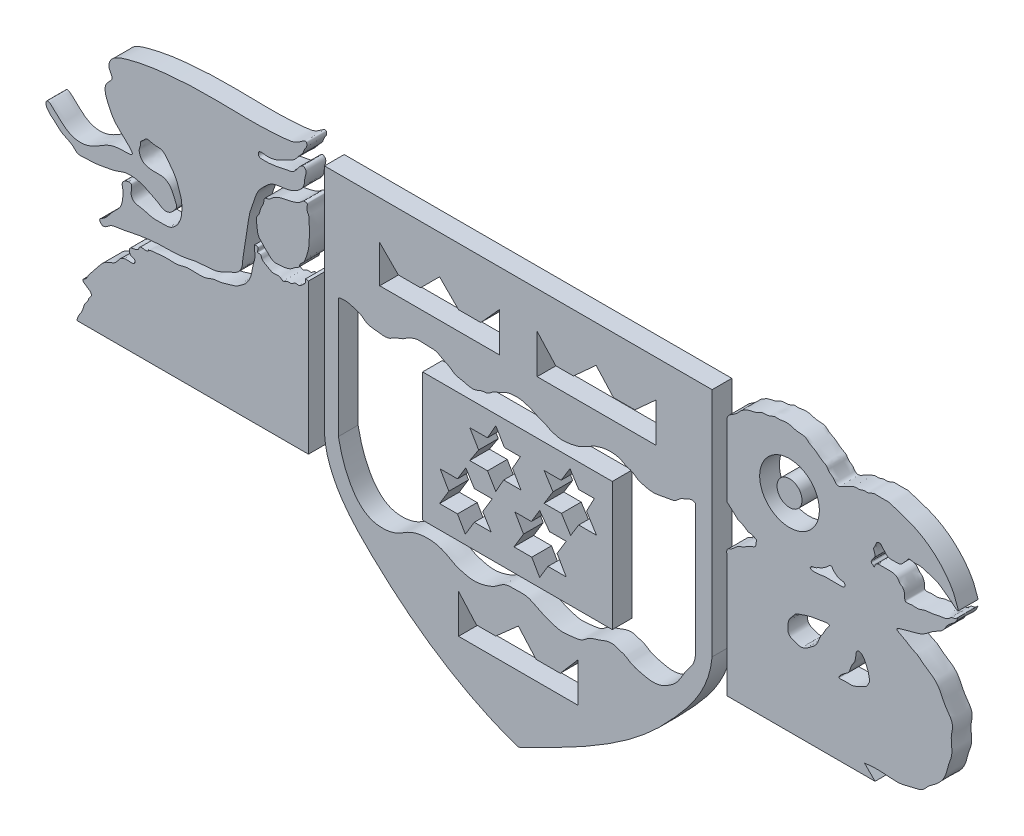
from build123d import *

# Parameters (mm, degrees)
SKETCH2_R             = 12.689747712
BOSS_EXTRUDE3_DEPTH   = 20
BOSS_EXTRUDE3_2_DEPTH = 20
BOSS_EXTRUDE3_3_DEPTH = 20
BOSS_EXTRUDE3_4_DEPTH = 20
BOSS_EXTRUDE3_5_DEPTH = 20
SKETCH2_W             = 192.522492042
SKETCH2_H             = 130.270801866
BOSS_EXTRUDE3_6_DEPTH = 20
SKETCH2_R_2           = 30.288047094
BOSS_EXTRUDE3_7_DEPTH = 20


with BuildPart() as part:
    # Sketch2 → Boss-Extrude3 (new body)
    with BuildSketch(Plane.XY):
        with Locations((273.141483895, 134.98628142)):
            Circle(SKETCH2_R)
    extrude(amount=BOSS_EXTRUDE3_DEPTH)


with BuildPart() as body_2:
    # Sketch2 → Boss-Extrude3 2 (new body)
    with BuildSketch(Plane.XY):
        with BuildLine():
            add(Edge.make_bspline(
                [(-481.365479162, 101.585089884), (-479.980275311, 107.590250914), (-458.884152858, 78.766782185), (-432.297797759, 84.675797976), (-415.385077689, 99.480070901), (-383.801991468, 96.053798849), (-410.328660839, 114.895950043), (-417.731362499, 129.66579025), (-425.618059534, 146.346775651), (-411.770282092, 155.390345469), (-419.121341407, 163.190583081), (-415.696788893, 174.003216805), (-403.86710429, 179.019176508), (-389.053447552, 182.771707918), (-370.908784754, 186.149129144), (-350.365415117, 188.189023369), (-325.915880829, 189.584768223), (-301.234129311, 189.367115347), (-275.381876158, 188.798506457), (-254.486466215, 189.08204438), (-236.560936818, 190.50116447), (-226.473154275, 192.43258324), (-216.860840656, 201.207128028), (-216.492382736, 194.193338735), (-219.576534764, 191.354765344), (-220.29058751, 186.677056338), (-224.856656335, 182.807848669), (-228.52136423, 176.665982495), (-236.783243501, 172.732579226), (-246.531612535, 167.452898195), (-255.512863483, 165.037111719), (-265.938700098, 167.460335412), (-266.249466519, 160.893656939), (-257.82181752, 160.479683657), (-248.948232475, 161.280758527), (-238.570413302, 163.895990267), (-227.544302831, 165.278963495), (-222.582789357, 178.687875877), (-216.508689646, 172.377223801), (-219.372025456, 166.566536385), (-218.720847421, 158.945480954), (-225.349302089, 150.942540946), (-237.481544296, 145.78405192), (-251.41219105, 146.29638615), (-259.735022438, 138.060456086), (-267.467361444, 130.653499517), (-270.475281553, 119.414736282), (-275.20396066, 107.597328411), (-276.198674872, 98.261254885), (-278.32821889, 87.630315093), (-279.100810216, 77.05197206), (-282.077016402, 65.509781745), (-281.823550518, 56.192135709), (-286.470421625, 48.342117997), (-296.361952965, 45.287992763), (-308.611417088, 37.507253371), (-325.585507364, 39.046445104), (-343.486269973, 33.717636972), (-359.955362916, 34.110553795), (-374.537681036, 33.294154813), (-389.894686996, 31.200922544), (-403.684284945, 27.625169058), (-416.716050535, 26.636104026), (-423.130522175, 18.73459674), (-428.637355706, 25.969782735), (-420.511815778, 29.199969904), (-417.014085854, 35.542753021), (-410.691152946, 41.717706696), (-404.871313248, 47.376562779), (-403.567933606, 55.854074579), (-402.987348257, 63.034706538), (-405.764243044, 71.384493611), (-392.650031265, 75.50950775), (-395.336553603, 66.593158231), (-395.117285701, 61.449014886), (-391.127959128, 57.064687807), (-382.945117458, 56.919958833), (-374.235234848, 52.981086428), (-364.471645886, 53.928957337), (-356.446751444, 53.311885335), (-350.278159727, 57.327388937), (-346.105681775, 62.856016192), (-343.711736165, 70.095154761), (-343.626161289, 77.56627044), (-343.791995542, 84.295804036), (-346.329637131, 91.106299113), (-348.369348968, 98.112056716), (-352.399105007, 105.360108321), (-356.811839102, 110.481622303), (-359.969002167, 115.012208001), (-364.670703627, 119.240782508), (-371.816881001, 117.681516881), (-379.41461789, 121.511647221), (-382.545960318, 116.827961889), (-386.337702442, 115.133253327), (-385.446480736, 110.669016053), (-387.003470499, 107.916060752), (-386.921760991, 104.410685779), (-385.732530374, 101.40736836), (-383.328906752, 97.610657514), (-377.083981788, 95.177150177), (-369.575900005, 95.156945905), (-362.020119857, 95.431009276), (-356.954631877, 92.165186518), (-353.95778307, 88.460275765), (-352.210019269, 83.928026038), (-350.35078436, 80.330224774), (-348.885754311, 76.915885278), (-349.258130439, 73.625031082), (-351.630656384, 71.146742994), (-354.378125207, 67.648755655), (-359.510905179, 65.593320291), (-364.481495431, 67.417876036), (-368.729772839, 70.844430826), (-374.096923615, 72.806079221), (-379.103264081, 75.945129712), (-384.033652411, 77.748480258), (-389.149976976, 79.556085052), (-395.226541794, 80.025268826), (-401.419759913, 79.799730414), (-407.107925804, 77.470718081), (-413.076377516, 75.542197964), (-418.881905024, 74.496544539), (-425.283159895, 73.177939451), (-433.522778079, 72.189202148), (-441.733778802, 72.212277585), (-449.424512029, 71.396552165), (-452.480725487, 74.87470275), (-457.282649404, 79.097881682), (-465.795899296, 81.494901295), (-471.335484496, 87.992313956), (-476.255506454, 91.449710531), (-479.095774129, 94.870619849), (-481.683800804, 97.985478923), (-481.556668738, 100.756241342), (-481.365479162, 101.585089884)],
                knots=[0, 0, 0, 0, 0.01770505, 0.043382401, 0.063353068, 0.07559002, 0.095889966, 0.105370566, 0.122865266, 0.129644926, 0.136402176, 0.142815438, 0.154224989, 0.165440181, 0.180768252, 0.19897202, 0.215876249, 0.240480477, 0.259273961, 0.278734336, 0.29230925, 0.301056126, 0.308129717, 0.310916149, 0.313831772, 0.318232341, 0.321559668, 0.328065109, 0.335248779, 0.343314382, 0.354742135, 0.360031, 0.362484834, 0.366861025, 0.376163259, 0.386745595, 0.392022786, 0.403564489, 0.405218727, 0.410819549, 0.416795828, 0.423753296, 0.434079113, 0.448613979, 0.454979546, 0.461868552, 0.474525629, 0.482328389, 0.493002349, 0.497201964, 0.508806894, 0.518781492, 0.526207695, 0.531078463, 0.539795189, 0.55032542, 0.565935551, 0.579331429, 0.595672121, 0.605749736, 0.61499398, 0.633505642, 0.640076904, 0.647400555, 0.651010123, 0.65490985, 0.663775226, 0.669553271, 0.676301209, 0.682985492, 0.689559267, 0.694460558, 0.701721735, 0.707402776, 0.710306345, 0.714723536, 0.720005089, 0.729591979, 0.737422381, 0.743695996, 0.748613814, 0.754589247, 0.760379373, 0.766858179, 0.772776386, 0.776612602, 0.784492867, 0.790564641, 0.79668319, 0.80088864, 0.804210332, 0.811210588, 0.81816357, 0.819669132, 0.82442001, 0.826202298, 0.829882386, 0.831776066, 0.834555599, 0.837702914, 0.842439711, 0.849958657, 0.856253229, 0.860209859, 0.86417144, 0.867706351, 0.871986834, 0.874097575, 0.876683385, 0.879479835, 0.882250829, 0.88759929, 0.891481326, 0.894602314, 0.900884939, 0.905226134, 0.908975692, 0.913669804, 0.918396655, 0.923777065, 0.928593438, 0.933269613, 0.939087228, 0.94295169, 0.949253844, 0.959102968, 0.963940894, 0.966224821, 0.96993218, 0.979610841, 0.986701986, 0.990337161, 0.994199725, 0.997556301, 1, 1, 1, 1], degree=3))
        make_face()
    extrude(amount=BOSS_EXTRUDE3_2_DEPTH)


with BuildPart() as body_3:
    # Sketch2 → Boss-Extrude3 3 (new body)
    with BuildSketch(Plane.XY):
        with BuildLine():
            add(Edge.make_bspline(
                [(-216.951067035, 145.125039879), (-215.564871807, 144.727941909), (-217.95863392, 139.042124698), (-214.470723472, 135.534264779), (-214.654783124, 130.866944718), (-214.520062246, 126.662593055), (-214.003740754, 122.587919073), (-214.206308686, 118.502559523), (-214.343075276, 114.194361482), (-214.382888083, 109.612097474), (-215.205445181, 104.309219763), (-216.531648429, 99.785240938), (-218.097713878, 95.428447113), (-219.455978691, 91.071811125), (-223.782688489, 88.918545588), (-224.492122321, 83.945799355), (-229.018402804, 82.619722978), (-232.11244182, 79.298454666), (-238.13023219, 76.865887751), (-243.886213683, 76.670940558), (-249.973825602, 76.19582064), (-253.638411146, 78.409241387), (-256.402655729, 81.748699043), (-259.872496494, 84.204469848), (-262.007207539, 87.288332125), (-265.036910636, 89.798187236), (-266.93845795, 93.712041116), (-267.09277614, 98.431723123), (-268.094158115, 103.097491093), (-268.143379305, 107.84790914), (-264.371866192, 111.509767904), (-264.240502116, 117.601312223), (-259.973724448, 121.916929008), (-260.6972662, 128.517465699), (-255.068375882, 128.580478227), (-251.960203547, 132.256168391), (-247.595248189, 134.832132206), (-243.15319706, 136.423738754), (-237.551813552, 137.418919998), (-232.086186743, 138.696469766), (-226.365184804, 140.464861491), (-222.781590852, 142.675188753), (-220.422545984, 145.293428583), (-218.425829381, 145.057651585), (-217.366481619, 145.244042083), (-216.951067035, 145.125039879)],
                knots=[0, 0, 0, 0, 0.028024893, 0.053073499, 0.072937865, 0.095207576, 0.117973658, 0.134884403, 0.157284325, 0.183515926, 0.204379478, 0.238643086, 0.254742122, 0.275232466, 0.305719409, 0.319238498, 0.345145347, 0.367469692, 0.388393031, 0.44111256, 0.454979686, 0.479822121, 0.501595531, 0.521231493, 0.543540581, 0.557888789, 0.58057296, 0.606863395, 0.628752125, 0.654184247, 0.673660057, 0.704075056, 0.739613203, 0.763030853, 0.782855235, 0.80832766, 0.834514151, 0.858981918, 0.879680065, 0.920777283, 0.944635865, 0.9694807, 0.986384132, 0.991601508, 1, 1, 1, 1], degree=3))
        make_face()
    extrude(amount=BOSS_EXTRUDE3_3_DEPTH)


with BuildPart() as body_4:
    # Sketch2 → Boss-Extrude3 4 (new body)
    with BuildSketch(Plane.XY):
        with BuildLine():
            Line((-215.137157753, 77.264201127), (-215.137157753, -74.946862607))
            Line((-215.137157753, -74.946862607), (-450.020089247, -74.946862607))
            add(Edge.make_bspline(
                [(-450.020089247, -74.946862607), (-449.783324712, -69.871368631), (-444.054919287, -65.348619869), (-443.09641741, -56.840491052), (-438.998313563, -53.190798404), (-438.203449655, -48.732336328), (-435.394480979, -46.551008217), (-435.378336939, -43.644597857), (-437.401261936, -41.839687438), (-439.751051441, -40.624009043), (-441.571983444, -38.728668329), (-444.15463442, -37.83817838), (-444.174203853, -35.157025744), (-440.831616858, -34.101005905), (-439.218535933, -30.404390521), (-436.613524127, -26.759561184), (-433.665592734, -22.969110128), (-430.085792185, -19.232909174), (-427.112460465, -14.750850418), (-423.717721475, -10.968844625), (-418.3093411, -7.321217422), (-410.491161787, -5.822442814), (-406.294166325, 3.161116427), (-398.616285574, 4.247644977), (-392.547502416, 3.000263195), (-391.058327066, 5.609946544), (-390.890914453, 8.453796616), (-395.768014228, 8.472219537), (-397.076899617, 12.386946297), (-396.334188418, 17.850326888), (-388.108801449, 15.657958469), (-386.366282511, 23.815965819), (-379.941806899, 20.179013309), (-376.314551774, 24.060650804), (-369.836961265, 24.505137138), (-363.197280711, 25.430923319), (-354.958285064, 25.418921279), (-347.328078543, 24.603978188), (-339.644361023, 27.936485312), (-331.674241455, 27.272064028), (-324.616585006, 27.227894882), (-317.868649098, 27.920112929), (-311.880385945, 31.151066913), (-303.096864166, 31.118835384), (-295.395730242, 34.546800023), (-288.170623987, 35.798584674), (-284.576688769, 38.982757537), (-278.878831182, 42.315075355), (-274.733651852, 48.408496524), (-272.49255624, 56.124183103), (-271.717830589, 62.444505848), (-269.815342141, 68.273155522), (-269.043718706, 72.808829046), (-269.885269351, 76.218700358), (-269.941766383, 78.695368384), (-269.601241778, 81.009835196), (-270.038930975, 81.567223951)],
                knots=[0, 0, 0, 0, 0.047871828, 0.066458996, 0.082725383, 0.100800293, 0.10992971, 0.116245522, 0.127541214, 0.13510863, 0.143157426, 0.15480681, 0.157507012, 0.168137701, 0.183324435, 0.197615104, 0.213720545, 0.232110517, 0.250062749, 0.268335386, 0.283322162, 0.316033343, 0.343418096, 0.373101464, 0.390342963, 0.396144131, 0.401832984, 0.415502922, 0.431642301, 0.437474586, 0.467946999, 0.480849268, 0.503638649, 0.515548022, 0.530331666, 0.567145531, 0.584760883, 0.613987862, 0.643782069, 0.666901782, 0.694106334, 0.716002753, 0.734802176, 0.761919152, 0.802723158, 0.82004862, 0.834609979, 0.850441366, 0.88713084, 0.905259087, 0.932159326, 0.951457058, 0.967644914, 0.978257754, 0.985864617, 0.99515669, 0.99515669, 0.99515669, 0.99515669], degree=3))
            add(Edge.make_bspline(
                [(-270.038930975, 81.567223951), (-269.813018793, 81.650468126), (-265.23005933, 82.396248602), (-266.457144665, 79.542504526), (-267.173105683, 75.827659903), (-263.419305602, 77.205474382), (-262.753237165, 71.949453977), (-256.990792499, 69.788469851), (-251.393026082, 64.999663298), (-244.707637464, 67.74510224), (-240.613116188, 62.832280936), (-236.741629695, 67.340044482), (-232.000764515, 65.362699839), (-229.179239898, 69.68879989), (-224.312867286, 67.721676385), (-220.622561297, 71.641460912), (-217.337956114, 74.320089554), (-218.324929756, 78.038959201), (-216.9945653, 77.88468765), (-215.740539429, 77.419819976), (-215.137157753, 77.264201127)],
                knots=[-0.003181907, -0.003181907, -0.003181907, -0.003181907, 0, 0.058315799, 0.090029056, 0.118904215, 0.17105142, 0.251574332, 0.371644178, 0.456214784, 0.511488875, 0.583928697, 0.637245157, 0.696302585, 0.756006237, 0.818658482, 0.905355023, 0.924418047, 0.939066288, 0.955633188, 0.955633188, 0.955633188, 0.955633188], degree=3))
        make_face()
    extrude(amount=BOSS_EXTRUDE3_4_DEPTH)


with BuildPart() as body_5:
    # Sketch2 → Boss-Extrude3 5 (new body)
    with BuildSketch(Plane.XY):
        with BuildLine():
            Line((-198.877820034, -48.265057327), (-198.877820034, 186.625479419))
            Line((-198.877820034, 186.625479419), (194.559406701, 186.625479419))
            Line((194.559406701, 186.625479419), (194.559406701, -48.265057327))
            add(Edge.make_bspline(
                [(194.559406701, -48.265057327), (191.810261199, -80.007541575), (168.923800063, -107.567644092), (106.16736638, -173.992617559), (47.742778933, -201.429234081), (-2.103341098, -226.009245766)],
                knots=[0, 0, 0, 0, 0.32922987, 0.379049607, 1, 1, 1, 1], degree=3))
            add(Edge.make_bspline(
                [(-198.877820034, -48.265057327), (-197.882863825, -70.527643704), (-183.242653451, -98.635720951), (-119.713985598, -164.80305689), (-60.929410609, -205.761019493), (-2.103341098, -226.009245766)],
                knots=[0, 0, 0, 0, 0.239264192, 0.328030027, 1, 1, 1, 1], degree=3))
        make_face()
        Polygon((-21.357153012, 109.269215941), (-142.803622278, 109.269215941), (-142.803622278, 147.23212508), (-123.822167709, 128.25067051), (-101.350030663, 128.25067051), (-82.080387645, 147.520313528), (-62.810744628, 128.25067051), (-40.245339488, 128.25067051), (-21.357153012, 149.085563608), align=None, mode=Mode.SUBTRACT)
        Polygon((16.970211381, 109.269215941), (137.833281609, 109.269215941), (137.833281609, 149.311432102), (116.168186011, 129.671470741), (94.452925279, 129.671470741), (76.810199002, 149.133390466), (53.800156051, 128.274200049), (35.879599154, 128.274200049), (16.970211381, 149.133390466), align=None, mode=Mode.SUBTRACT)
        Polygon((-62.810744628, -158.8379751), (58.604062432, -158.8379751), (58.604062432, -118.678786853), (40.435937309, -139.738404145), (15.869212939, -139.738404145), (-2.103341098, -119.441738133), (-25.02466048, -139.738404145), (-44.6465631, -139.738404145), (-62.810744628, -119.225330429), align=None, mode=Mode.SUBTRACT)
        with BuildLine():
            Line((-184.783882303, 77.809297223), (-184.783882303, -44.26966337))
            add(Edge.make_bspline(
                [(-184.783882303, -44.26966337), (-181.708800441, -61.188580076), (-169.830327615, -100.174378016), (-136.507082538, -103.015023704), (-124.001807238, -99.631365149), (-111.7127697, -90.55663681), (-97.781362439, -87.561833984), (-84.520889539, -89.058612111), (-75.902824104, -92.147537597), (-67.784938136, -97.43508406), (-58.062244216, -100.684808824), (-46.954245007, -103.027316407), (-35.539965905, -100.778023145), (-24.711662643, -96.586691923), (-16.413746978, -88.638986987), (-4.655382205, -89.15816339), (6.716642421, -87.978397077), (17.807076428, -94.42159982), (28.95050952, -99.003445296), (41.39996736, -103.24269935), (52.474480993, -101.30135204), (63.058231603, -100.423560518), (69.758864933, -93.096281425), (78.576324077, -91.56002556), (85.858902291, -88.236994134), (93.456436742, -86.525514097), (100.292799737, -89.19746963), (106.77574485, -91.142451318), (113.379635441, -96.437766656), (122.117911478, -98.239189159), (132.394036077, -100.860521862), (142.435973474, -100.112665501), (151.229783119, -94.957055113), (158.612519175, -89.38207443), (163.798915369, -81.028801941), (168.830516655, -72.345029992), (178.353232827, -61.974120842), (177.934700365, -50.803329014), (177.921924915, -44.26966337)],
                knots=[0, 0, 0, 0, 0.151714457, 0.184463045, 0.215867804, 0.236777782, 0.286538261, 0.306439594, 0.326270513, 0.347459295, 0.371239824, 0.394881742, 0.422889428, 0.447852656, 0.472850901, 0.495566656, 0.523748507, 0.548117679, 0.578982994, 0.606020137, 0.634174491, 0.654027698, 0.674894083, 0.696728182, 0.712285126, 0.729180066, 0.747028197, 0.76041139, 0.774531543, 0.802841865, 0.818868329, 0.846204253, 0.867455114, 0.886772075, 0.907772506, 0.932715821, 0.95470146, 1, 1, 1, 1], degree=3))
            Line((177.921924915, -44.26966337), (177.921924915, 77.809297223))
            add(Edge.make_bspline(
                [(-184.783882303, 77.809297223), (-178.273592776, 79.903534535), (-170.253182469, 77.387882564), (-161.066429345, 74.133689551), (-157.116872697, 70.138639793), (-151.795476568, 68.418766999), (-146.215342831, 68.131260947), (-139.95657587, 67.101320705), (-133.128602747, 67.01408203), (-127.742524083, 71.629050324), (-122.377679908, 72.866902669), (-117.354812542, 75.302219786), (-113.52263957, 78.607837925), (-109.327998066, 79.716663906), (-104.484337266, 81.724448085), (-97.749076631, 80.456178623), (-90.662204113, 80.981779471), (-84.965472958, 80.370293947), (-80.999978333, 78.009086349), (-77.135461971, 75.829581217), (-72.92258534, 74.239422375), (-69.702779139, 71.901717553), (-65.38603112, 68.528083613), (-58.96665664, 68.392677546), (-52.228983605, 65.900278752), (-45.433574854, 65.609752735), (-39.47092551, 69.29445993), (-32.529550215, 68.824890029), (-28.107669617, 74.078861625), (-22.1539217, 75.529008035), (-16.981289443, 78.397813556), (-11.865541003, 80.747598031), (-6.396269587, 80.954804185), (-1.434825898, 81.293360423), (2.66501113, 80.447608506), (6.475818159, 79.327752825), (10.120295241, 78.273221784), (14.170730115, 76.263504835), (18.26189878, 74.293328269), (22.603641735, 72.718952691), (26.741515406, 71.208086446), (30.731954191, 68.597627651), (35.546016274, 67.371625668), (40.429714584, 66.105363549), (45.719893108, 66.278962643), (51.559231788, 67.087040467), (57.429245608, 68.266430108), (62.053932627, 70.160336692), (65.548582261, 72.436463127), (69.524168141, 73.729048619), (73.310781999, 76.837214488), (77.269520764, 78.124257804), (85.384598985, 80.701943595), (94.015373141, 81.349510646), (103.033392044, 78.607770748), (106.834852485, 75.749788797), (111.571051, 74.93609443), (115.546627466, 72.696426169), (119.372067532, 69.500979725), (126.305582212, 67.709878812), (133.259876734, 65.805557124), (141.639208786, 67.070866886), (148.807321961, 68.884860013), (157.152055018, 69.235606966), (161.843416992, 75.122564989), (169.29639816, 77.258212111), (174.627498547, 81.165190971), (177.921924915, 77.809297223)],
                knots=[0, 0, 0, 0, 0.049407706, 0.065122315, 0.074372347, 0.092393799, 0.10676486, 0.117843588, 0.142180204, 0.155821761, 0.17114646, 0.18431165, 0.199026787, 0.209637255, 0.217700793, 0.239370334, 0.260408185, 0.273654453, 0.282771414, 0.295926932, 0.308260163, 0.317461829, 0.326841724, 0.350181412, 0.364489128, 0.383112174, 0.400304793, 0.417495058, 0.432809671, 0.449694388, 0.463959744, 0.478948115, 0.492747378, 0.506085129, 0.517509302, 0.525005387, 0.537029757, 0.546899349, 0.560102897, 0.572320856, 0.582811458, 0.59426449, 0.609033297, 0.621099216, 0.633345517, 0.6498001, 0.667025631, 0.679734987, 0.688384366, 0.699340847, 0.711839079, 0.725847663, 0.731278793, 0.778229989, 0.789510833, 0.804052358, 0.814254567, 0.826240684, 0.839143856, 0.852467896, 0.881209245, 0.894273397, 0.91755184, 0.939885167, 0.954672687, 0.972449103, 1, 1, 1, 1], degree=3))
        make_face(mode=Mode.SUBTRACT)
    extrude(amount=BOSS_EXTRUDE3_5_DEPTH)


with BuildPart() as body_6:
    # Sketch2 → Boss-Extrude3 6 (new body)
    with BuildSketch(Plane.XY):
        with Locations((-3.022674074, -9.811461674)):
            Rectangle(SKETCH2_W, SKETCH2_H)
        Polygon((-33.398834305, 30.385190087), (-25.02466048, 45.136358142), (-16.219602522, 30.385190087), (0, 30.385190087), (-8.109801261, 16.099716223), (0.648528275, 1.426832584), (-17.015646802, 1.426832584), (-25.02466048, -12.68110322), (-33.398834305, 1.34820198), (-51.440503281, 1.34820198), (-42.419668793, 15.144081162), (-51.440503281, 30.256740972), align=None, mode=Mode.SUBTRACT)
        Polygon((24.041086561, 1.426832584), (33.068851595, 16.099716223), (24.041086561, 30.385190087), (41.276843678, 30.385190087), (50.352774658, 45.136358142), (59.17235576, 31.180313114), (75.012426854, 31.180313114), (67.092391307, 16.099716223), (77.266674399, 0), (59.17235576, 0), (50.975339856, -13.32266182), (41.654335098, 1.426832584), align=None, mode=Mode.SUBTRACT)
        Polygon((19.524580819, -7.023157223), (11.07796379, -20.975488556), (-5.541142214, -20.975488556), (3.137033029, -36.046660724), (-6.584774295, -52.105382987), (11.539227069, -52.105382987), (19.524580819, -65.973349215), (27.980139766, -52.0062474), (46.48115675, -52.0062474), (37.230648258, -35.941118244), (46.48115675, -20.66089907), (29.620698765, -20.66089907), align=None, mode=Mode.SUBTRACT)
        Polygon((-63.878069307, -20.975488556), (-81.450760125, -20.975488556), (-72.664414716, -36.234517174), (-82.080387645, -51.788054606), (-63.878069307, -51.788054606), (-55.894677575, -65.652613445), (-46.783095512, -50.60187639), (-29.756435023, -50.60187639), (-38.269765267, -36.843320935), (-28.663520978, -20.975488556), (-46.783095512, -20.975488556), (-55.416327737, -7.023157223), align=None, mode=Mode.SUBTRACT)
    extrude(amount=BOSS_EXTRUDE3_6_DEPTH)


with BuildPart() as body_7:
    # Sketch2 → Boss-Extrude3 7 (new body)
    with BuildSketch(Plane.XY):
        with BuildLine():
            Line((209.523638275, 168.453465662), (209.523638275, 95.673963892))
            add(Edge.make_bspline(
                [(209.523638275, 95.673963892), (212.540527021, 93.328604515), (216.28627943, 89.745082503), (221.534656587, 84.471679784), (227.100563351, 83.521574843), (230.630774992, 79.393840847), (235.322657166, 79.946005528), (237.367832486, 78.038799875), (240.263034518, 77.188873024), (238.580551295, 74.091329007), (239.250105751, 71.40201133), (236.888178167, 69.330654937), (233.138882646, 68.654554855), (229.475203508, 65.987868553), (225.26479438, 63.518724215), (221.470666945, 62.818141194), (218.722883272, 60.231076717), (216.178812162, 57.981854263), (213.710581585, 56.004698303), (210.040852185, 55.01602589), (208.897239671, 51.998024546), (209.523638275, 50.209995386)],
                knots=[0, 0, 0, 0, 0.140698208, 0.20271976, 0.272940121, 0.345409982, 0.388020299, 0.434701112, 0.450170469, 0.487486171, 0.528266006, 0.550952961, 0.595482085, 0.670908526, 0.718194966, 0.780085286, 0.810482516, 0.858459424, 0.909933773, 0.926875613, 1, 1, 1, 1], degree=3))
            Line((209.523638275, 50.209995386), (209.523638275, -74.946862607))
            Line((209.523638275, -74.946862607), (359.956683164, -74.946862607))
            Line((359.956683164, -74.946862607), (349.220578203, -64.210757645))
            add(Edge.make_bspline(
                [(349.220578203, -64.210757645), (357.66776901, -62.769240028), (369.185180827, -63.362164011), (385.883945675, -64.929188913), (396.716556661, -61.025560217), (408.395484617, -59.459024678), (413.900081064, -51.634372455), (420.927172342, -47.339888221), (427.314781305, -41.422772938), (432.42167109, -33.278561151), (433.987060572, -23.051061083), (438.044991318, -14.770988977), (437.918628054, -5.338995496), (436.459671546, 3.550192281), (439.670009867, 12.77280451), (436.09675323, 20.528934656), (430.943546873, 26.736373776), (427.511732727, 34.339719799), (423.574476905, 42.283426195), (416.808285468, 47.974004292), (408.996723956, 52.336329009), (403.407699108, 58.101874615), (396.761190786, 60.28400782), (391.612760213, 64.226371195), (387.037586541, 66.358955777), (379.184116418, 70.471454306), (388.948384922, 72.795145314), (394.005118265, 74.167852734), (400.81060494, 76.212857194), (410.069781636, 78.442952608), (418.115697411, 87.011188654), (429.166751415, 90.918887965), (432.714889784, 98.809642645), (438.211305387, 103.112786744), (441.898423444, 105.457087701), (445.203894145, 112.866065365), (441.605750465, 108.049031467), (437.543896482, 108.753683721), (434.426022356, 104.642479989), (429.722649074, 103.574977525), (424.30938743, 102.987178842), (417.942199303, 101.178994113), (410.743565579, 101.276539538), (403.702241913, 97.781618654), (397.608478465, 99.410008265), (388.999812578, 96.992682107), (390.520354836, 104.281686355), (389.009669565, 107.916438576), (387.648133495, 110.156602295), (384.928886055, 111.404663063), (383.598528301, 114.686454887), (379.859991456, 117.458721302), (374.675679653, 117.75103848), (369.574213608, 117.602180052), (364.489912407, 117.807707516), (359.92509109, 117.138834544), (359.197523787, 111.761243014), (357.751940739, 114.528359001), (355.289532051, 115.379981278), (357.269323756, 118.930955465), (358.566920139, 120.859279574), (360.293892101, 122.259139674), (359.830033333, 125.492137737), (357.597624195, 128.890058013), (360.6299511, 132.56192704), (361.193005383, 136.88045315), (366.444772748, 136.96431309), (367.531964147, 133.583427088), (370.203919278, 132.008052846), (371.966934356, 128.872163819), (376.219996755, 128.118226765), (379.810107724, 128.330614714), (383.353024145, 128.150889551), (386.987655185, 129.012761433), (389.199270943, 132.475329854), (392.000884236, 134.305884955), (393.718556439, 138.660722033), (399.204715764, 136.710353208), (405.866306147, 137.732168197), (413.872831917, 135.019656367), (421.502549603, 132.956250127), (427.495731118, 129.1889327), (431.524940067, 125.993046492), (436.656705268, 122.641424237), (439.263981622, 119.797292006), (445.958959928, 115.142538416), (441.992079658, 123.318484313), (440.813404972, 128.431532696), (428.893956133, 150.306371226), (408.767581151, 166.52325387), (386.734293485, 173.195649436), (381.552577292, 175.378582209), (377.28071201, 175.929630465), (373.608865911, 177.827090021), (369.58110792, 177.335158057), (365.91587339, 177.515553902), (362.361138054, 177.402197363), (358.944051836, 177.755488908), (355.829193912, 176.29244233), (352.622611978, 174.763519497), (348.377950127, 175.680906541), (344.52633169, 173.242018665), (339.095382741, 174.110285426), (335.044788564, 171.510514587), (329.929310485, 169.516924267), (326.520058599, 167.092274281), (322.271060621, 165.52367179), (319.052255505, 167.915704387), (317.294242034, 171.490340454), (312.928522268, 173.324107456), (311.437597443, 177.712291666), (307.166767333, 179.63815027), (303.190510647, 182.220410412), (299.778124284, 185.572933362), (295.79914578, 187.346374077), (292.691581253, 189.12984251), (289.709035789, 192.688936013), (284.553686888, 192.930908602), (279.599362221, 193.223994964), (274.784033001, 195.018403091), (268.790565642, 196.064330372), (263.002242725, 194.184730977), (257.545672823, 195.189523676), (252.390993905, 191.501382735), (245.65957421, 192.901937579), (240.438918694, 189.160386204), (235.5233086, 187.975766977), (230.726000787, 187.096502749), (227.348265399, 184.940037271), (223.779941815, 183.154068185), (221.186798932, 179.608924787), (215.582956945, 174.977455925), (210.244829743, 172.930169315), (209.523638275, 168.453465662)],
                knots=[0, 0, 0, 0, 0.031361117, 0.043465497, 0.061520541, 0.074158067, 0.084973392, 0.095187191, 0.104739949, 0.117216745, 0.130045872, 0.142913289, 0.150735975, 0.164685856, 0.176248444, 0.184987968, 0.194870499, 0.206408481, 0.215856333, 0.227584637, 0.238504847, 0.249277956, 0.256638874, 0.26430829, 0.272368294, 0.278549035, 0.286957106, 0.295021267, 0.302067512, 0.312509173, 0.330137868, 0.344438749, 0.353290767, 0.361269557, 0.368640892, 0.374074423, 0.377473951, 0.383049595, 0.38866147, 0.394517809, 0.400489131, 0.409060852, 0.418936305, 0.427068907, 0.436548358, 0.443557314, 0.451728311, 0.455346018, 0.458867434, 0.460991428, 0.466114981, 0.471205536, 0.477465811, 0.484934392, 0.490191183, 0.496906321, 0.500020538, 0.502694172, 0.504368481, 0.509063274, 0.512753719, 0.51437039, 0.516689039, 0.523823713, 0.527196617, 0.533340957, 0.537534872, 0.542147737, 0.544869818, 0.548854513, 0.554800589, 0.559382266, 0.562470286, 0.568087884, 0.572092, 0.577186467, 0.580516064, 0.587438884, 0.593758452, 0.606610384, 0.61752864, 0.623292925, 0.632703694, 0.636963033, 0.645412385, 0.650355131, 0.657188879, 0.665180596, 0.674553942, 0.745433339, 0.754858854, 0.760344258, 0.766259719, 0.770782772, 0.775259458, 0.780946884, 0.784508569, 0.788534846, 0.793453627, 0.797049744, 0.80146516, 0.808729298, 0.812625258, 0.821182055, 0.82557036, 0.833078557, 0.837068862, 0.841063207, 0.846511002, 0.851672604, 0.857442125, 0.862238549, 0.868392492, 0.875246412, 0.879744429, 0.884521913, 0.888516864, 0.896412906, 0.902143918, 0.907200169, 0.915419563, 0.924216075, 0.929355937, 0.935086371, 0.946295055, 0.952270055, 0.958129613, 0.965047289, 0.970182106, 0.972932653, 0.979795672, 0.986043226, 1, 1, 1, 1], degree=3))
        make_face()
        with Locations((273.141483895, 134.98628142)):
            Circle(SKETCH2_R_2, mode=Mode.SUBTRACT)
        with BuildLine():
            add(Edge.make_bspline(
                [(313.509156846, 38.779037166), (313.687948044, 40.667842081), (303.730069718, 38.812038381), (297.582713808, 37.969757801), (290.783781233, 36.228275537), (284.744622755, 34.02800745), (278.871498286, 32.155684309), (276.482221331, 28.143216875), (273.641222893, 25.491142691), (271.858255718, 21.988769493), (271.525718954, 17.408556273), (270.900007225, 12.776876098), (274.045710686, 8.458923849), (278.460230923, 7.645918275), (282.062675978, 5.453010035), (286.347728359, 5.580752565), (290.389030408, 7.14935579), (294.031517931, 10.077743737), (298.191605173, 12.874271365), (302.085791944, 17.608832288), (303.617775619, 24.004995039), (308.107470248, 29.297556166), (309.833250724, 34.140378807), (313.424639175, 37.886166629), (313.509156846, 38.779037166)],
                knots=[0, 0, 0, 0, 0.085361901, 0.137297058, 0.189090578, 0.25523666, 0.306170338, 0.336248954, 0.370220968, 0.40499024, 0.432326745, 0.487230711, 0.517286867, 0.557452015, 0.596745279, 0.621659493, 0.663200622, 0.70464358, 0.739874971, 0.790531394, 0.855694058, 0.903896073, 0.959647963, 1, 1, 1, 1], degree=3))
        make_face(mode=Mode.SUBTRACT)
        with BuildLine():
            add(Edge.make_bspline(
                [(323.726963899, -2.257726284), (322.398750234, -1.450795469), (328.379794816, 4.517754968), (333.697282478, 6.800968767), (334.95906786, 12.165076207), (336.773514461, 16.42266196), (339.440271814, 19.546022431), (340.013074019, 22.952040522), (340.671747013, 26.349937185), (340.397648785, 30.06290282), (343.777928999, 31.521421436), (346.956955745, 30.20224186), (349.310229675, 26.758032354), (351.062210592, 22.545623659), (353.096648904, 18.262525487), (353.64964646, 14.107938425), (354.982174112, 10.126405674), (352.778090332, 7.325622624), (351.941854227, 4.149874342), (348.848642798, 2.94634482), (346.282545215, 1.353536821), (343.488537096, 0.15837545), (340.510396735, -1.168462454), (337.070420214, -2.659878577), (333.072230662, -2.170318898), (330.030820629, -2.283749087), (327.19535073, -2.199809908), (324.435324057, -2.688076953), (323.726963899, -2.257726284)],
                knots=[0, 0, 0, 0, 0.081735929, 0.133987165, 0.190844262, 0.228094181, 0.273757709, 0.308804037, 0.327816348, 0.379240738, 0.399301892, 0.425336929, 0.474278055, 0.518835344, 0.562011282, 0.613036012, 0.645892612, 0.676772342, 0.712537456, 0.736356554, 0.769865013, 0.803609607, 0.825903827, 0.867284268, 0.911954487, 0.943352987, 0.956408764, 1, 1, 1, 1], degree=3))
        make_face(mode=Mode.SUBTRACT)
        with BuildLine():
            add(Edge.make_bspline(
                [(314.702988104, 91.981063802), (313.373861067, 91.63451876), (312.114174766, 89.800873223), (309.703137768, 88.086129982), (307.484906807, 86.627917242), (305.21561284, 84.858616407), (302.366519405, 84.530795759), (299.58739152, 81.908281037), (295.826922321, 82.555247999), (292.578540943, 78.003708567), (303.552813737, 78.240056031), (308.295204116, 79.650645958), (313.914603972, 79.456875205), (318.565698662, 79.471533452), (323.113173751, 79.600339842), (326.509529461, 79.285665656), (329.620181991, 80.081026707), (329.472030706, 84.524586972), (325.453467688, 84.555639572), (322.175059893, 85.29767313), (320.26673558, 87.188125095), (318.085568057, 88.483071388), (317.02789823, 90.096354539), (316.131352951, 92.161847441), (315.071125316, 92.077048702), (314.702988104, 91.981063802)],
                knots=[0, 0, 0, 0, 0.049660566, 0.077696209, 0.112100946, 0.150351732, 0.184064146, 0.21587216, 0.288688383, 0.300787265, 0.407001996, 0.49621884, 0.546319555, 0.609677347, 0.675011505, 0.715840199, 0.741617733, 0.783753186, 0.828467594, 0.869410336, 0.912100769, 0.926428136, 0.964286093, 0.986245181, 1, 1, 1, 1], degree=3))
        make_face(mode=Mode.SUBTRACT)
    extrude(amount=BOSS_EXTRUDE3_7_DEPTH)


solid = Compound([part.part, body_2.part, body_3.part, body_4.part, body_5.part, body_6.part, body_7.part])
